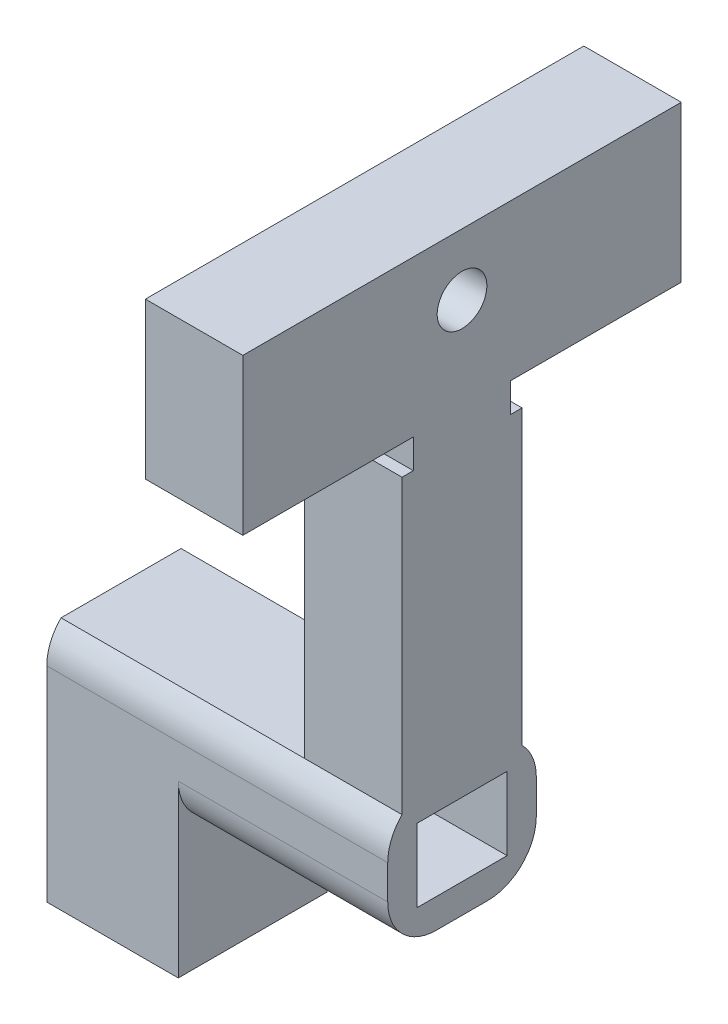
from build123d import *

# Parameters (mm, degrees)
SKETCH1_W            = 15
SKETCH1_H            = 18.5
BOSS_EXTRUDE1_DEPTH  = 10
SKETCH3_W            = 60
SKETCH3_H            = 24.642135624
BOSS_EXTRUDE2_DEPTH  = 20
BOSS_EXTRUDE3_DEPTH  = 20
SKETCH5_R            = 5.1
CUT_EXTRUDE1_DEPTH   = 120.21693154
SKETCH6_W            = 15
SKETCH6_H            = 18.5
BOSS_EXTRUDE4_DEPTH  = 50
BOSS_EXTRUDE5_DEPTH  = 25
SKETCH8_W            = 3
SKETCH8_H            = 30.5
BOSS_EXTRUDE6_DEPTH  = 25
SKETCH9_W            = 25
SKETCH9_H            = 1.5
BOSS_EXTRUDE7_DEPTH  = 22
BOSS_EXTRUDE11_START = 2
BOSS_EXTRUDE11_DEPTH = 2


with BuildPart() as part:
    # Sketch1 → Boss-Extrude1 (new, symmetric)
    with BuildSketch(Plane.YZ):
        with BuildLine():
            Line((13.5, 5.25), (13.5, -5.25))
            ThreePointArc((13.5, -5.25), (10.571067812, -12.321067812), (3.5, -15.25))
            Line((3.5, -15.25), (-3.5, -15.25))
            ThreePointArc((-3.5, -15.25), (-10.571067812, -12.321067812), (-13.5, -5.25))
            Line((-13.5, -5.25), (-13.5, 5.25))
            ThreePointArc((-13.5, 5.25), (-10.571067812, 12.321067812), (-3.5, 15.25))
            Line((-3.5, 15.25), (3.5, 15.25))
            ThreePointArc((3.5, 15.25), (10.571067812, 12.321067812), (13.5, 5.25))
        make_face()
        Rectangle(SKETCH1_W, SKETCH1_H, mode=Mode.SUBTRACT)
    extrude(amount=BOSS_EXTRUDE1_DEPTH, both=True)

    # Sketch3 → Boss-Extrude2 (add)
    with BuildSketch(Plane.YZ.offset(10)):
        with Locations((40.571067812, 0)):
            Rectangle(SKETCH3_W, SKETCH3_H)
    extrude(amount=-BOSS_EXTRUDE2_DEPTH)

    # Sketch4 → Boss-Extrude3 (add)
    with BuildSketch(Plane.YZ.offset(10)):
        Polygon((70.571067812, 10), (76.571067812, 10), (76.571067812, 45), (108.571067812, 45), (108.571067812, -45), (76.571067812, -45), (76.571067812, -10), (70.571067812, -10), align=None)
    extrude(amount=-BOSS_EXTRUDE3_DEPTH)

    # Sketch5 → Cut-Extrude1 (cut, through all)
    with BuildSketch(Plane.YZ.offset(10)):
        with Locations(Location((95.921067812, 0, 0), (0, 0, 270))):
            Circle(SKETCH5_R)
    extrude(amount=-CUT_EXTRUDE1_DEPTH, mode=Mode.SUBTRACT)

    # Sketch6 → Boss-Extrude4 (add)
    with BuildSketch(Plane(origin=(-10, 0, 0), x_dir=(0, -1, 0), z_dir=(-1, 0, 0))):
        with BuildLine():
            Line((-10.571067812, 12.321067812), (-10.571067812, -12.321067812))
            ThreePointArc((-10.571067812, -12.321067812), (-7.326834324, -14.488795325), (-3.5, -15.25))
            Line((-3.5, -15.25), (3.5, -15.25))
            ThreePointArc((3.5, -15.25), (10.571067812, -12.321067812), (13.5, -5.25))
            Line((13.5, -5.25), (13.5, 5.25))
            ThreePointArc((13.5, 5.25), (10.571067812, 12.321067812), (3.5, 15.25))
            Line((3.5, 15.25), (-3.5, 15.25))
            ThreePointArc((-3.5, 15.25), (-7.326834324, 14.488795325), (-10.571067812, 12.321067812))
        make_face()
        Rectangle(SKETCH6_W, SKETCH6_H, mode=Mode.SUBTRACT)
    extrude(amount=BOSS_EXTRUDE4_DEPTH)

    # Sketch7 → Boss-Extrude5 (add)
    with BuildSketch(Plane(origin=(-60, 0, 0), x_dir=(0, -1, 0), z_dir=(-1, 0, 0))):
        Polygon((3.5, 15.25), (13.5, 15.25), (13.5, -15.25), (3.5, -15.25), (3.5, -9.25), (7.5, -9.25), (7.5, 9.25), (3.5, 9.25), align=None)
    extrude(amount=-BOSS_EXTRUDE5_DEPTH)

    # Sketch8 → Boss-Extrude6 (add)
    with BuildSketch(Plane.XZ.offset(13.5)):
        with Locations((-58.5, 0)):
            Rectangle(SKETCH8_W, SKETCH8_H)
    extrude(amount=BOSS_EXTRUDE6_DEPTH)

    # Sketch9 → Boss-Extrude7 (add)
    with BuildSketch(Plane.YZ.offset(-57)):
        with Locations((-26, 14.5)):
            Rectangle(SKETCH9_W, SKETCH9_H)
        with Locations((-26, -14.5)):
            Rectangle(SKETCH9_W, SKETCH9_H)
    extrude(amount=BOSS_EXTRUDE7_DEPTH)

    # Sketch10 → Boss-Extrude11 (add)
    with BuildSketch(Plane.YZ.offset(-35).offset(BOSS_EXTRUDE11_START)):
        with BuildLine():
            Line((-3.5, 15.25), (-38.5, 15.25))
            Line((-38.5, 15.25), (-38.5, 13.75))
            Line((-38.5, 13.75), (-13.5, 13.75))
            Line((-13.5, 13.75), (-13.5, 5.25))
            ThreePointArc((-13.5, 5.25), (-10.571067812, 12.321067812), (-3.5, 15.25))
        make_face()
        Polygon((-13.5, 13.75), (-38.5, 13.75), (-38.5, -13.75), (-13.5, -13.75), (-13.5, -5.25), (-13.5, 5.25), align=None)
        with BuildLine():
            Line((-13.5, -13.75), (-38.5, -13.75))
            Line((-38.5, -13.75), (-38.5, -15.25))
            Line((-38.5, -15.25), (-3.5, -15.25))
            ThreePointArc((-3.5, -15.25), (-10.571067812, -12.321067812), (-13.5, -5.25))
            Line((-13.5, -5.25), (-13.5, -13.75))
        make_face()
    extrude(amount=-BOSS_EXTRUDE11_DEPTH)


solid = part.part
